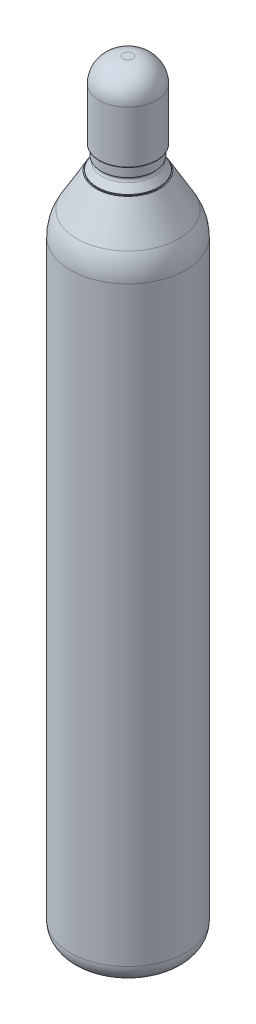
from build123d import *


with BuildPart() as part:
    # 草图1 → 旋转1 (revolve)
    with BuildSketch(Plane.XY, mode=Mode.PRIVATE) as revolve_1_sk:
        with BuildLine():
            Line((0, 0), (-40, 0))
            ThreePointArc((-40, 0), (-54.142135624, 5.857864376), (-60, 20))
            Line((-60, 20), (-60, 636.602540378))
            ThreePointArc((-60, 636.602540378), (-58.296291314, 649.543492634), (-53.301270189, 661.602540378))
            Line((-53.301270189, 661.602540378), (-33.094010768, 696.602540378))
            Line((-33.094010768, 696.602540378), (-32.094010768, 696.602540378))
            Line((-32.094010768, 696.602540378), (-32.094010768, 697.602540378))
            Line((-32.094010768, 697.602540378), (-26.953288465, 704.686382138))
            ThreePointArc((-26.953288465, 704.686382138), (-26.24428987, 706.07929983), (-26, 707.623068324))
            Line((-26, 707.623068324), (-26, 710))
            Line((-26, 710), (-28, 710))
            Line((-28, 710), (-28, 719.1))
            ThreePointArc((-28, 719.1), (-28.263603897, 719.736396103), (-28.9, 720))
            Line((-28.9, 720), (-29, 720))
            ThreePointArc((-29, 720), (-29.707106781, 720.292893219), (-30, 721))
            Line((-30, 721), (-30, 775))
            ThreePointArc((-30, 775), (-22.67766953, 792.67766953), (-5, 800))
            Line((-5, 800), (0, 800))
            Line((0, 800), (0, 795))
            Line((0, 795), (-5, 795))
            ThreePointArc((-5, 795), (-19.142135624, 789.142135624), (-25, 775))
            Line((-25, 775), (-25, 725))
            Line((-25, 725), (-23, 725))
            Line((-23, 725), (-23, 715))
            Line((-23, 715), (-21, 715))
            Line((-21, 715), (-21, 704.376931676))
            Line((-21, 704.376931676), (-27.094010768, 695.979472054))
            Line((-27.094010768, 695.979472054), (-27.094010768, 691.602540378))
            Line((-27.094010768, 691.602540378), (-30.207259422, 691.602540378))
            Line((-30.207259422, 691.602540378), (-48.97114317, 659.102540378))
            ThreePointArc((-48.97114317, 659.102540378), (-53.466662183, 648.249397408), (-55, 636.602540378))
            Line((-55, 636.602540378), (-55, 20))
            ThreePointArc((-55, 20), (-50.606601718, 9.393398282), (-40, 5))
            Line((-40, 5), (0, 5))
            Line((0, 5), (0, 0))
        make_face()
    revolve(revolve_1_sk.sketch.rotate(Axis((0, 0, 0), (0, -1, 0)), 270), axis=Axis((0, 0, 0), (0, -1, 0)))


solid = part.part
